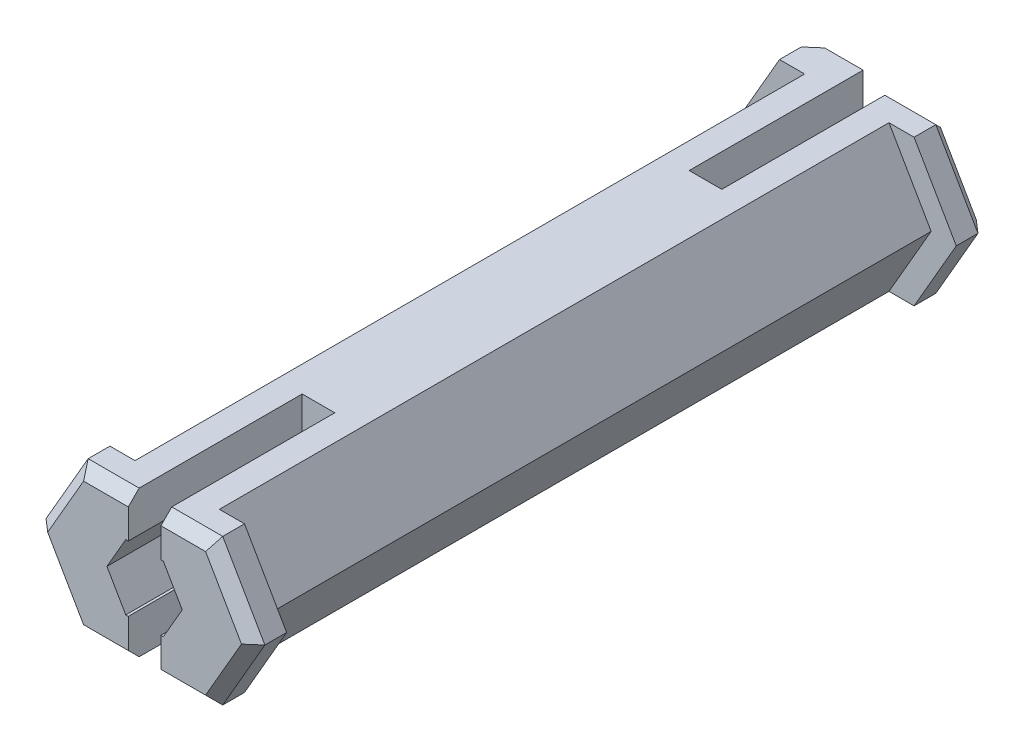
from build123d import *

# Parameters (mm, degrees)
BOSS_EXTRU_1_DEPTH      = 15.4
BOSS_EXTRU_2_DEPTH      = 1.5
ESQUISSE4_W             = 1.5
ESQUISSE4_H             = 0.855256697
ESQUISSE4_H_2           = 1.86
ESQUISSE4_H_3           = 3
ENL_V_MAT_EXTRU_1_DEPTH = 8
CHANFREIN1_SIZE         = 0.5


with BuildPart() as part:
    # Esquisse1 → Boss.-Extru.1 (new, symmetric)
    with BuildSketch(Plane(origin=(0, 0, 0), x_dir=(0, 1, 0), z_dir=(0, 0, 1))):
        Polygon((0, 3.879793809), (-3.36, 1.939896904), (-3.36, -1.939896904), (0, -3.879793809), (3.36, -1.939896904), (3.36, 1.939896904), align=None)
    extrude(amount=BOSS_EXTRU_1_DEPTH, both=True)

    # Esquisse2 → Boss.-Extru.2 (add)
    with BuildSketch(Plane.XY.offset(15.4)):
        Polygon((-1.939896904, 3.36), (-3.094597443, 3.36), (-5.034494347, 0), (-3.094597443, -3.36), (-1.939896904, -3.36), (-3.879793809, 0), align=None)
        Polygon((3.094597443, 3.36), (1.939896904, 3.36), (3.879793809, 0), (1.939896904, -3.36), (3.094597443, -3.36), (5.034494347, 0), align=None)
        Polygon((1.939896904, 3.36), (-1.939896904, 3.36), (-3.879793809, 0), (-1.939896904, -3.36), (1.939896904, -3.36), (3.879793809, 0), align=None)
    boss_extru_2 = extrude(amount=BOSS_EXTRU_2_DEPTH)

    # Esquisse4 → Enlèv. mat.-Extru.1 (cut)
    with BuildSketch(Plane.XY.offset(16.9)):
        with Locations((0, 3.787628349)):
            Rectangle(ESQUISSE4_W, ESQUISSE4_H)
        with Locations((0, 2.43)):
            Rectangle(ESQUISSE4_W, ESQUISSE4_H_2)
        Rectangle(ESQUISSE4_W, ESQUISSE4_H_3)
        with Locations((0, -2.43)):
            Rectangle(ESQUISSE4_W, ESQUISSE4_H_2)
        Polygon((0.75, 1.5), (0.75, -1.5), (0.866025404, -1.5), (1.732050808, 0), (0.866025404, 1.5), align=None)
        Polygon((-0.866025404, 1.5), (-1.732050808, 0), (-0.866025404, -1.5), (-0.75, -1.5), (-0.75, 1.5), align=None)
    enl_v_mat_extru_1 = extrude(amount=-ENL_V_MAT_EXTRU_1_DEPTH, mode=Mode.SUBTRACT)

    # Symétrie2: Boss.-Extru.2, Enlèv. mat.-Extru.1 across plane
    add(boss_extru_2.mirror(Plane.XY))
    add(enl_v_mat_extru_1.mirror(Plane.XY), mode=Mode.SUBTRACT)

    # Chanfrein1
    chanfrein1_edges = [part.edges().sort_by_distance(p)[0] for p in [
        (1.922298721, -3.36, -16.9),
        (1.922298721, 3.36, -16.9),
        (-1.922298721, 3.36, 16.9),
        (-1.922298721, -3.36, 16.9),
        (4.064545895, -1.68, 16.9),
        (4.064545895, 1.68, 16.9),
        (-4.064545895, 1.68, 16.9),
        (-4.064545895, -1.68, 16.9),
        (1.922298721, -3.36, 16.9),
        (1.922298721, 3.36, 16.9),
        (-4.064545895, -1.68, -16.9),
        (-4.064545895, 1.68, -16.9),
        (4.064545895, 1.68, -16.9),
        (4.064545895, -1.68, -16.9),
    ]]
    chamfer(chanfrein1_edges, length=CHANFREIN1_SIZE)


solid = part.part
